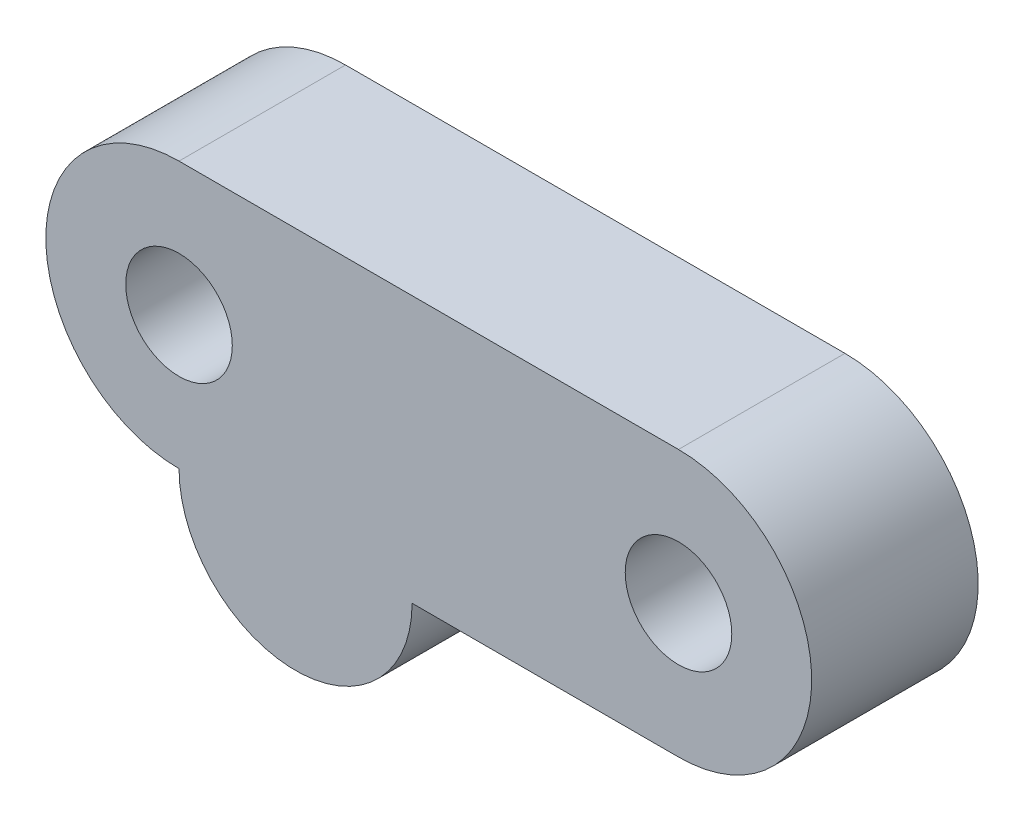
from build123d import *

# Parameters (mm, degrees)
SKETCH1_R           = 1.6
BOSS_EXTRUDE1_DEPTH = 5
CUT_EXTRUDE1_DEPTH  = 2


with BuildPart() as part:
    # Sketch1 → Boss-Extrude1 (new body)
    with BuildSketch(Plane.XY):
        with BuildLine():
            Line((0, 4), (15, 4))
            ThreePointArc((15, 4), (19, 0), (15, -4))
            Line((15, -4), (7, -4))
            ThreePointArc((7, -4), (3.5, -7.5), (0, -4))
            ThreePointArc((0, -4), (-4, 0), (0, 4))
        make_face()
        Circle(SKETCH1_R, mode=Mode.SUBTRACT)
        with Locations((15, 0)):
            Circle(SKETCH1_R, mode=Mode.SUBTRACT)
    extrude(amount=BOSS_EXTRUDE1_DEPTH)

    # Sketch2 → Cut-Extrude1 (cut)
    with BuildSketch(Plane(origin=(0, 0, 0), x_dir=(-1, 0, 0), z_dir=(0, 0, -1))):
        Polygon((3.464101615, 0), (1.732050808, 3), (-1.732050808, 3), (-3.464101615, 0), (-1.732050808, -3), (1.732050808, -3), align=None)
        Polygon((-11.535898385, 0), (-13.267949192, 3), (-16.732050808, 3), (-18.464101615, 0), (-16.732050808, -3), (-13.267949192, -3), align=None)
    extrude(amount=-CUT_EXTRUDE1_DEPTH, mode=Mode.SUBTRACT)


solid = part.part
